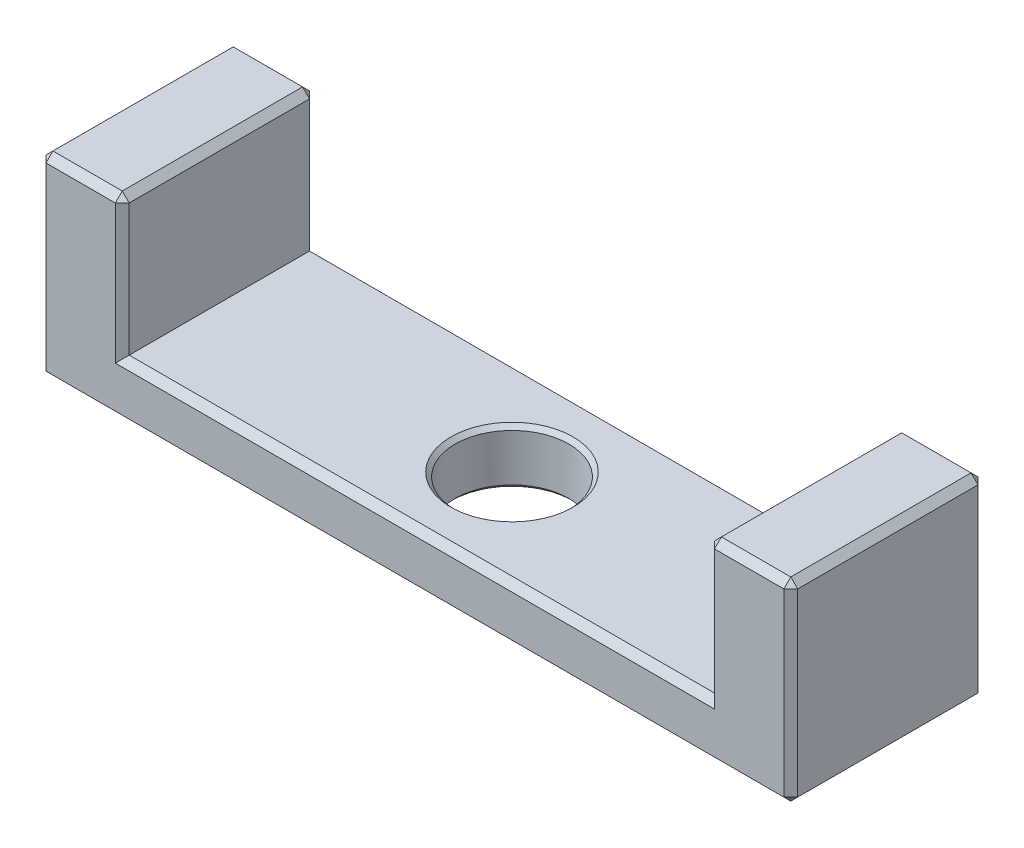
from build123d import *

# Parameters (mm, degrees)
BOSS_EXTRUDE1_DEPTH = 7
SKETCH2_R           = 4.1
CUT_EXTRUDE1_DEPTH  = 30.722213915
CHAMFER1_SIZE       = 0.5
CHAMFER2_SIZE       = 0.3


with BuildPart() as part:
    # Sketch1 → Boss-Extrude1 (new, symmetric)
    with BuildSketch(Plane.XY):
        Polygon((-21.1, 14), (-21.1, 4), (21.1, 4), (21.1, 14), (27.1, 14), (27.1, 0), (-27.1, 0), (-27.1, 14), align=None)
    extrude(amount=BOSS_EXTRUDE1_DEPTH, both=True)

    # Sketch2 → Cut-Extrude1 (cut, through all)
    with BuildSketch(Plane(origin=(0, 4, 0), x_dir=(1, 0, 0), z_dir=(0, 1, 0))):
        with Locations(Location((0, 0, 0), (0, 0, 270))):
            Circle(SKETCH2_R)
    extrude(amount=-CUT_EXTRUDE1_DEPTH, mode=Mode.SUBTRACT)

    # Chamfer1
    chamfer1_edges = [part.edges().sort_by_distance(p)[0] for p in [
        (27.1, 7, -7),
        (0, 0, -7),
        (-27.1, 7, -7),
        (-24.1, 14, -7),
        (0, 0, 7),
        (-21.1, 14, 0),
        (21.1, 14, 0),
        (27.1, 14, 0),
        (27.1, 0, 0),
        (-27.1, 0, 0),
        (-27.1, 14, 0),
        (27.1, 7, 7),
        (24.1, 14, 7),
        (21.1, 9, 7),
        (0, 4, 7),
        (-21.1, 9, 7),
        (-24.1, 14, 7),
        (-21.1, 9, -7),
        (-27.1, 7, 7),
        (0, 4, -7),
        (21.1, 9, -7),
        (24.1, 14, -7),
    ]]
    chamfer(chamfer1_edges, length=CHAMFER1_SIZE)

    # Chamfer2
    chamfer2_edges = [part.edges().sort_by_distance(p)[0] for p in [
        (0, 0, -4.1),
        (0, 4, -4.1),
    ]]
    chamfer(chamfer2_edges, length=CHAMFER2_SIZE)


solid = part.part
